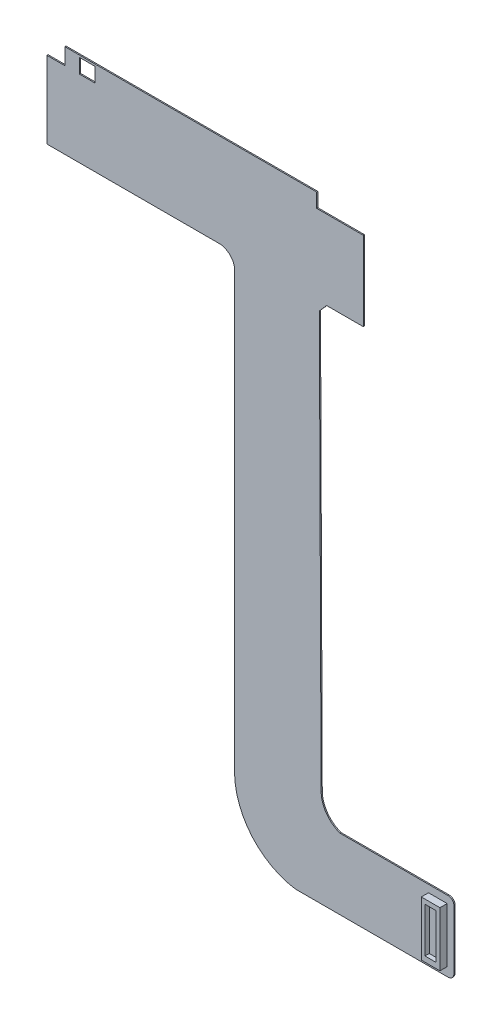
from build123d import *

# Parameters (mm, degrees)
ESQUISSE1_W             = 2.725699057
ESQUISSE1_H             = 2.506306443
BOSS_EXTRU_1_DEPTH      = 0.2
ESQUISSE2_W             = 3.234923292
ESQUISSE2_H             = 9.478551462
BOSS_EXTRU_2_DEPTH      = 1.25
ESQUISSE3_W             = 1.880186225
ESQUISSE3_H             = 7.770248285
ENL_V_MAT_EXTRU_1_DEPTH = 0.75
CONG_1_R                = 1


with BuildPart() as part:
    # Esquisse1 → Boss.-Extru.1 (new body)
    with BuildSketch(Plane.XY):
        with BuildLine():
            Line((126.422039537, 160.93295612), (170.054893457, 160.93295612))
            Line((170.054893457, 160.93295612), (170.054893457, 158.48132271))
            Line((170.054893457, 158.48132271), (178.126916218, 158.48132271))
            Line((178.126916218, 158.48132271), (178.126916218, 144.756393673))
            Line((178.126916218, 144.756393673), (171.779679926, 144.756393673))
            Line((171.779679926, 144.756393673), (170.514624307, 143.320028439))
            Line((170.514624307, 143.320028439), (170.819971895, 71.257993621))
            ThreePointArc((170.819971895, 71.257993621), (171.74909254, 68.47783045), (174.09562451, 66.721026494))
            Line((174.09562451, 66.721026494), (193.829857273, 66.721026494))
            Line((193.829857273, 66.721026494), (193.829857273, 54.476275086))
            Line((193.829857273, 54.476275086), (166.335216501, 54.476275086))
            ThreePointArc((166.335216501, 54.476275086), (158.91775161, 58.528592216), (155.831660909, 66.397270867))
            Line((155.831660909, 66.397270867), (155.831660909, 142.383251424))
            ThreePointArc((155.831660909, 142.383251424), (155.025193292, 143.979631476), (153.414150222, 144.756393673))
            Line((153.414150222, 144.756393673), (123.308343674, 144.756393673))
            Line((123.308343674, 144.756393673), (123.308343674, 158.075350221))
            Line((123.308343674, 158.075350221), (126.422039537, 158.075350221))
            Line((126.422039537, 158.075350221), (126.422039537, 160.93295612))
        make_face()
        with Locations((130.26793419, 159.328503442)):
            Rectangle(ESQUISSE1_W, ESQUISSE1_H, mode=Mode.SUBTRACT)
    extrude(amount=BOSS_EXTRU_1_DEPTH)

    # Esquisse2 → Boss.-Extru.2 (add)
    with BuildSketch(Plane.XY.offset(0.2)):
        with Locations((191.04638423, 60.711911726)):
            Rectangle(ESQUISSE2_W, ESQUISSE2_H)
    extrude(amount=BOSS_EXTRU_2_DEPTH)

    # Esquisse3 → Enlèv. mat.-Extru.1 (cut)
    with BuildSketch(Plane.XY.offset(1.45)):
        with Locations((191.008183709, 60.791242391)):
            Rectangle(ESQUISSE3_W, ESQUISSE3_H)
    extrude(amount=-ENL_V_MAT_EXTRU_1_DEPTH, mode=Mode.SUBTRACT)

    # Congé1
    cong_1_edges = [part.edges().sort_by_distance(p)[0] for p in [
        (193.829857273, 66.721026494, 0.1),
        (193.829857273, 54.476275086, 0.1),
    ]]
    fillet(cong_1_edges, radius=CONG_1_R)


solid = part.part
